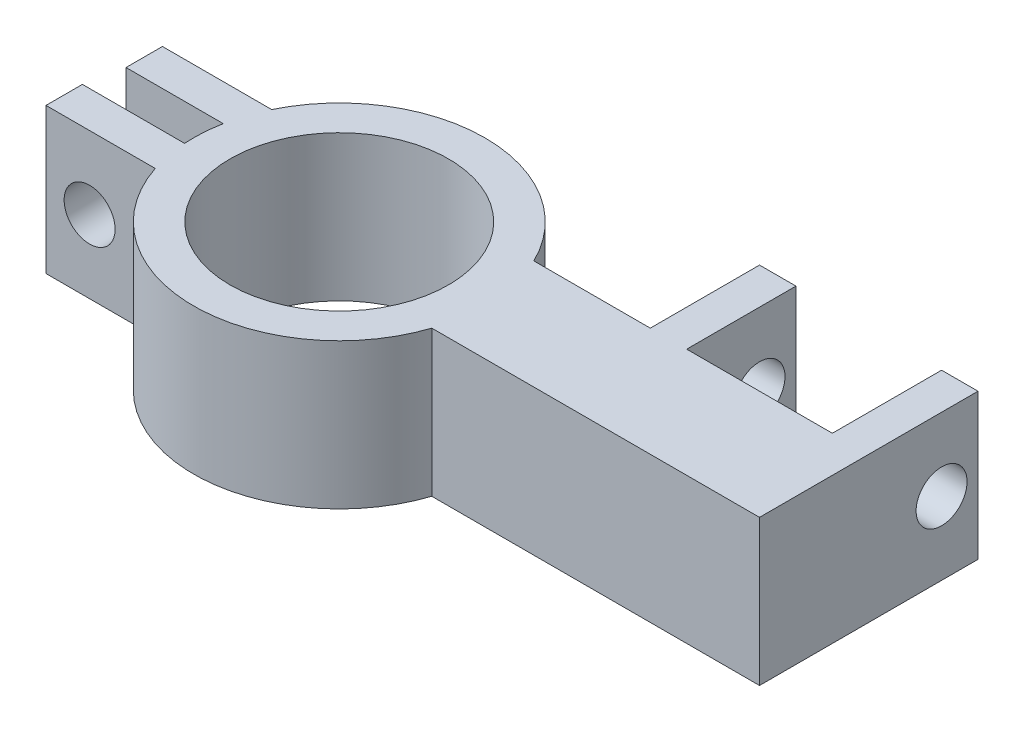
from build123d import *

# Parameters (mm, degrees)
SKETCH2_R           = 15
BOSS_EXTRUDE1_DEPTH = 20
SKETCH3_R           = 3.5
CUT_EXTRUDE1_DEPTH  = 36.5
SKETCH4_R           = 3.5
CUT_EXTRUDE2_DEPTH  = 36.5


with BuildPart() as part:
    # Sketch2 → Boss-Extrude1 (new body)
    with BuildSketch(Plane(origin=(0, 0, 0), x_dir=(1, 0, 0), z_dir=(0, 1, 0))):
        with BuildLine():
            Line((0, 0), (0, 30))
            Line((0, 30), (-5, 30))
            Line((-5, 30), (-5, 15))
            Line((-5, 15), (-25, 15))
            Line((-25, 15), (-25, 30))
            Line((-25, 30), (-30, 30))
            Line((-30, 30), (-30, 15))
            Line((-30, 15), (-45.987731213, 15))
            ThreePointArc((-45.987731213, 15), (-63.987731213, 26.282202113), (-81.987731213, 15))
            Line((-81.987731213, 15), (-96.987731213, 15))
            Line((-96.987731213, 15), (-96.987731213, 10))
            Line((-96.987731213, 10), (-83.639142838, 10))
            ThreePointArc((-83.639142838, 10), (-83.950029119, 7.509663844), (-83.946587837, 5))
            Line((-83.946587837, 5), (-97.975462426, 5))
            Line((-97.975462426, 5), (-97.975462426, 0))
            Line((-97.975462426, 0), (-82.975462426, 0))
            ThreePointArc((-82.975462426, 0), (-63.987731213, -13.717797887), (-45, 0))
            Line((-45, 0), (0, 0))
        make_face()
        with Locations(Location((-63.987731213, 6.282202113, 0), (0, 0, 270))):
            Circle(SKETCH2_R, mode=Mode.SUBTRACT)
    extrude(amount=-BOSS_EXTRUDE1_DEPTH)

    # Sketch3 → Cut-Extrude1 (cut, symmetric)
    with BuildSketch(Plane(origin=(0, 0, 0), x_dir=(0, 0, -1), z_dir=(1, 0, 0))):
        with Locations((25, -10)):
            Circle(SKETCH3_R)
    extrude(amount=CUT_EXTRUDE1_DEPTH, both=True, mode=Mode.SUBTRACT)

    # Sketch4 → Cut-Extrude2 (cut, symmetric)
    with BuildSketch(Plane(origin=(0, 0, -15), x_dir=(-1, 0, 0), z_dir=(0, 0, -1))):
        with Locations((91.987731213, -10)):
            Circle(SKETCH4_R)
    extrude(amount=CUT_EXTRUDE2_DEPTH, both=True, mode=Mode.SUBTRACT)


solid = part.part
